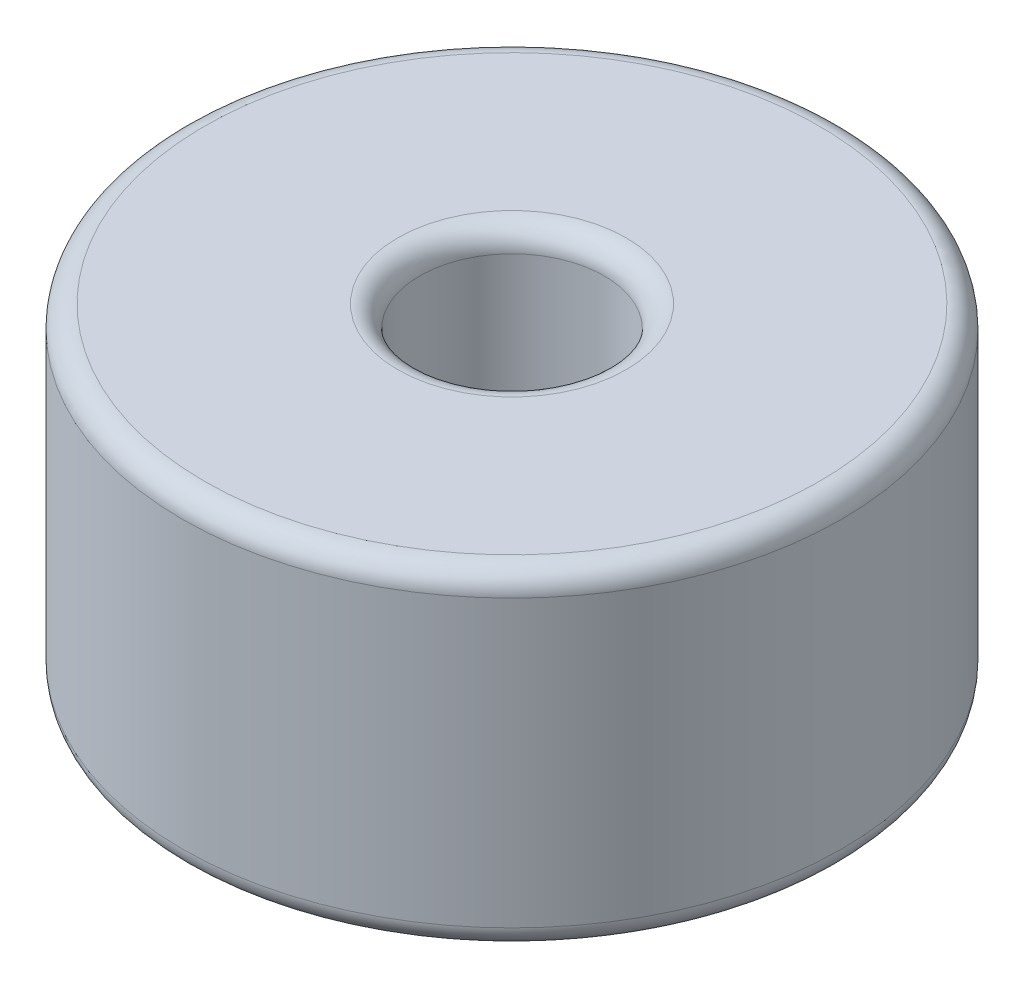
from build123d import *

# Parameters (mm, degrees)
SKETCH1_R           = 7.5
SKETCH1_R_2         = 2.1
BOSS_EXTRUDE1_DEPTH = 7.5
FILLET1_R           = 0.5


with BuildPart() as part:
    # Sketch1 → Boss-Extrude1 (new body)
    with BuildSketch(Plane(origin=(0, 0, 0), x_dir=(1, 0, 0), z_dir=(0, 1, 0))):
        with Locations(Location((0, 0, 0), (0, 0, 270))):
            Circle(SKETCH1_R)
        with Locations(Location((0, 0, 0), (0, 0, 270))):
            Circle(SKETCH1_R_2, mode=Mode.SUBTRACT)
    extrude(amount=BOSS_EXTRUDE1_DEPTH)

    # Fillet1
    fillet1_edges = [part.edges().sort_by_distance(p)[0] for p in [
        (0, 0, -7.5),
        (0, 7.5, -7.5),
        (0, 0, -2.1),
        (0, 7.5, -2.1),
    ]]
    fillet(fillet1_edges, radius=FILLET1_R)


solid = part.part
